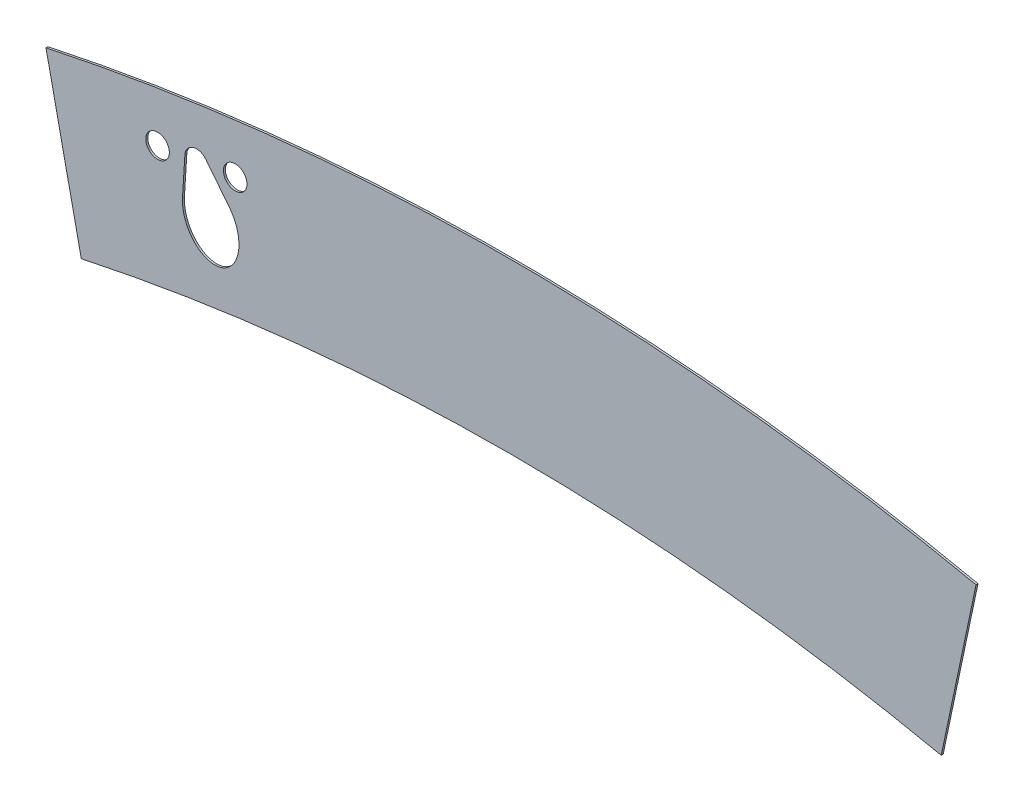
from build123d import *

# Parameters (mm, degrees)
SKETCH1_R          = 19.05
BASE_EXTRUDE_DEPTH = 3.175


with BuildPart() as part:
    # Sketch1 → Base-Extrude (new body)
    with BuildSketch(Plane.XY):
        with BuildLine():
            Line((-752.475, -79.774296229), (-695.3504, -346.781975691))
            ThreePointArc((-695.3504, -346.781975691), (0.389674853, -273.050022898), (696.1124, -346.945505398))
            Line((696.1124, -346.945505398), (752.475, -79.774296229))
            ThreePointArc((752.475, -79.774296229), (0, 0), (-752.475, -79.774296229))
        make_face()
        with Locations((-446.3034, -108.204)):
            Circle(SKETCH1_R, mode=Mode.SUBTRACT)
        with Locations((-571.9318, -126.7714)):
            Circle(SKETCH1_R, mode=Mode.SUBTRACT)
        with BuildLine():
            Line((-527.768777415, -117.465403312), (-531.604993281, -179.217083351))
            add(Edge.make_bspline(
                [(-531.604993281, -179.217083351), (-537.072397888, -267.226056703), (-468.944973872, -245.915384382), (-400.817549855, -224.604712061), (-455.462578204, -155.39927311)],
                knots=[1.113887128, 1.113887128, 1.113887128, 3.141592654, 3.141592654, 5.169298179, 5.169298179, 5.169298179], degree=2, weights=[1, 0.52859414, 1, 0.52859414, 1]))
            Line((-455.462578204, -155.39927311), (-493.80437652, -106.841132272))
            ThreePointArc((-493.80437652, -106.841132272), (-514.442639374, -100.465315857), (-527.768777415, -117.465403312))
        make_face(mode=Mode.SUBTRACT)
    extrude(amount=-BASE_EXTRUDE_DEPTH)


solid = part.part
